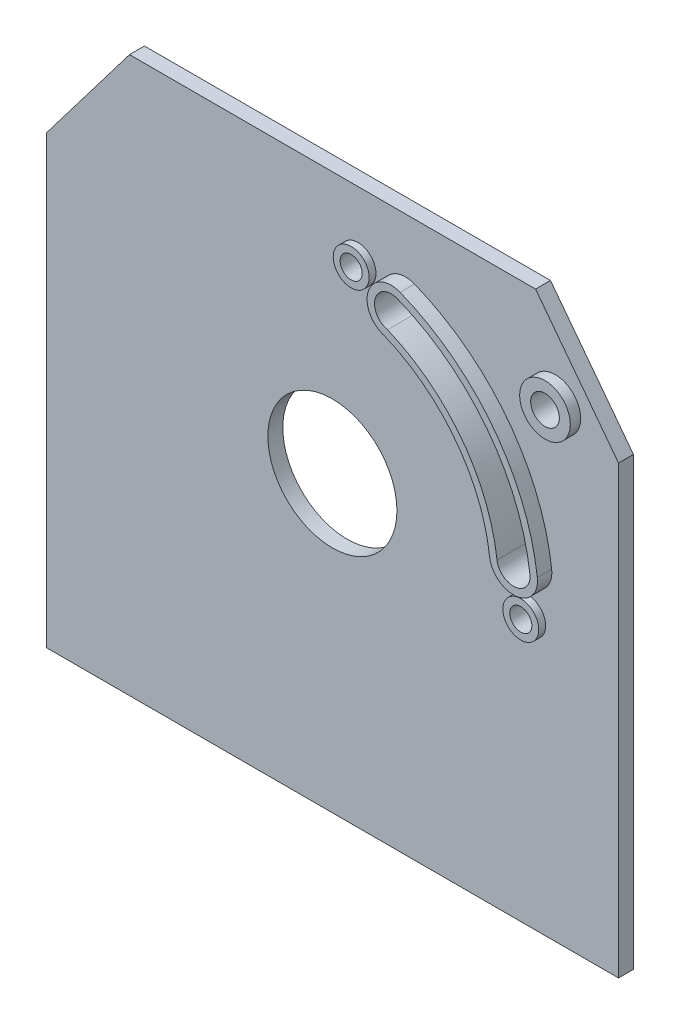
from build123d import *

# Parameters (mm, degrees)
SKETCH1_R      = 14.280154621
SKETCH1_R_2    = 3.175
SKETCH1_R_3    = 2.445943814
EXTRUDE1_DEPTH = 3.302
EXTRUDE2_DEPTH = 3.175
SKETCH3_R      = 3.969943814
SKETCH3_R_2    = 2.445943814
EXTRUDE3_DEPTH = 1.524
SKETCH4_R      = 5.604581629
SKETCH4_R_2    = 3.175
EXTRUDE4_DEPTH = 2.286


with BuildPart() as part:
    # Sketch1 → Extrude1 (new body)
    with BuildSketch(Plane.XY):
        Polygon((122.018241697, 78.932176277), (103.665120274, 103.090232189), (13.814462921, 103.090232189), (-4.538658503, 78.932176277), (-4.538658503, -19.747260734), (122.018241697, -19.747260734), align=None)
        with Locations((58.710249945, 45.283910371)):
            Circle(SKETCH1_R, mode=Mode.SUBTRACT)
        with Locations((108.031447678, 83.274598732)):
            Circle(SKETCH1_R_2, mode=Mode.SUBTRACT)
        with Locations((64.386022104, 88.408658993)):
            Circle(SKETCH1_R_3, mode=Mode.SUBTRACT)
        with Locations(Location((101.914361119, 39.6877037, 0), (0, 0, 180))):
            Circle(SKETCH1_R_3, mode=Mode.SUBTRACT)
        with BuildLine():
            ThreePointArc((105.584923307, 50.978901238), (96.144059082, 74.065464486), (76.258457488, 89.121432379))
            ThreePointArc((76.258457488, 89.121432379), (71.3691103, 86.793097674), (74.070723534, 82.099682674))
            ThreePointArc((74.070723534, 82.099682674), (90.512346787, 69.36651562), (98.311501424, 50.088712183))
            ThreePointArc((98.311501424, 50.088712183), (102.393306893, 46.897095769), (105.584923307, 50.978901238))
        make_face(mode=Mode.SUBTRACT)
    extrude(amount=EXTRUDE1_DEPTH)

    # Sketch2 → Extrude2 (add)
    with BuildSketch(Plane.XY.offset(3.302)):
        with BuildLine():
            ThreePointArc((96.672625226, 49.888999726), (89.234697097, 68.318816731), (73.552104701, 80.526896868))
            ThreePointArc((73.552104701, 80.526896868), (69.816708658, 87.358865324), (76.871357609, 90.654453557))
            ThreePointArc((76.871357609, 90.654453557), (97.452472431, 75.07236814), (107.223783381, 51.178746493))
            ThreePointArc((107.223783381, 51.178746493), (102.593085742, 45.258227686), (96.672625226, 49.888999726))
        make_face()
        with BuildLine():
            ThreePointArc((98.311501424, 50.088712183), (102.393306893, 46.897095769), (105.584923307, 50.978901238))
            ThreePointArc((105.584923307, 50.978901238), (96.144059082, 74.065464486), (76.258457488, 89.121432379))
            ThreePointArc((76.258457488, 89.121432379), (71.3691103, 86.793097674), (74.070723534, 82.099682674))
            ThreePointArc((74.070723534, 82.099682674), (90.512346787, 69.36651562), (98.311501424, 50.088712183))
        make_face(mode=Mode.SUBTRACT)
    extrude(amount=EXTRUDE2_DEPTH)

    # Sketch3 → Extrude3 (add)
    # profile 1 of 2: a face of its own
    with BuildSketch(Plane.XY.offset(3.302)):
        with Locations(Location((64.386022104, 88.408658993, 0), (0, 0, 180))):
            Circle(SKETCH3_R)
        with Locations((64.386022104, 88.408658993)):
            Circle(SKETCH3_R_2, mode=Mode.SUBTRACT)
    # profile 2 of 2: a face of its own
    with BuildSketch(Plane.XY.offset(3.302)):
        with Locations(Location((101.914361119, 39.6877037, 0), (0, 0, 180))):
            Circle(SKETCH3_R)
        with Locations(Location((101.914361119, 39.6877037, 0), (0, 0, 180))):
            Circle(SKETCH3_R_2, mode=Mode.SUBTRACT)
    extrude(amount=EXTRUDE3_DEPTH)

    # Sketch4 → Extrude4 (add)
    with BuildSketch(Plane.XY.offset(3.302)):
        with Locations(Location((108.031447678, 83.274598732, 0), (0, 0, 180))):
            Circle(SKETCH4_R)
        with Locations((108.031447678, 83.274598732)):
            Circle(SKETCH4_R_2, mode=Mode.SUBTRACT)
    extrude(amount=EXTRUDE4_DEPTH)


solid = part.part
